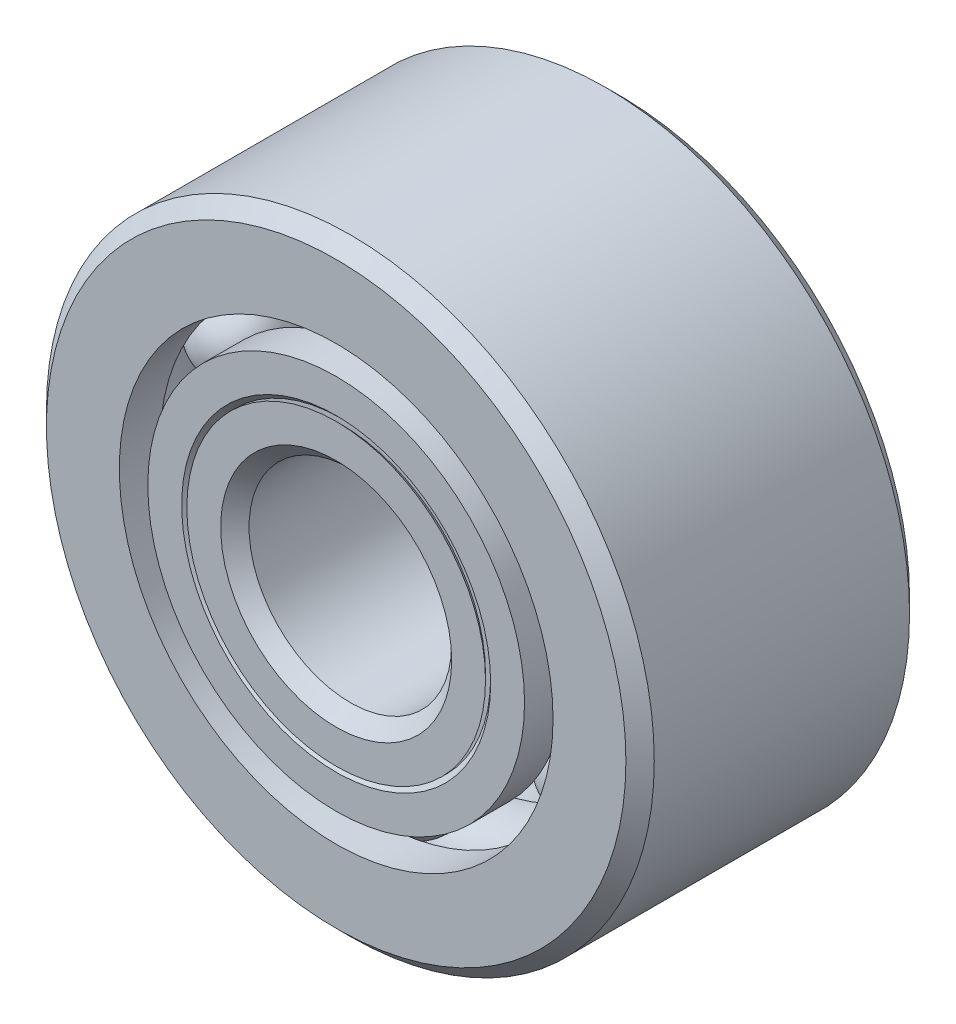
from build123d import *

# Parameters (mm, degrees)
CIRPATTERN1_COUNT = 6


with BuildPart() as part:
    # Sketch1 → Revolve1 (revolve)
    with BuildSketch(Plane(origin=(0, 0, 0), x_dir=(0, 0, -1), z_dir=(1, 0, 0)), mode=Mode.PRIVATE) as revolve1_sk:
        with BuildLine():
            Line((6.3, 15), (-6.3, 15))
            Line((-6.3, 15), (-7, 14.3))
            Line((-7, 14.3), (-7, 10.703296703))
            Line((-7, 10.703296703), (-5, 10.703296703))
            ThreePointArc((-5, 10.703296703), (-3, 12.120053361), (-1, 10.703296703))
            Line((-1, 10.703296703), (1, 10.703296703))
            ThreePointArc((1, 10.703296703), (3, 12.120053361), (5, 10.703296703))
            Line((5, 10.703296703), (7, 10.703296703))
            Line((7, 10.703296703), (7, 14.3))
            Line((7, 14.3), (6.3, 15))
        make_face()
    revolve(revolve1_sk.sketch.rotate(Axis((0, 0, 7), (0, 0, -1)), 90), axis=Axis((0, 0, 7), (0, 0, -1)))


with BuildPart() as body_2:
    # Sketch3 → Revolve3 (revolve)
    with BuildSketch(Plane(origin=(0, 0, 0), x_dir=(0, 0, -1), z_dir=(1, 0, 0)), mode=Mode.PRIVATE) as revolve3_sk:
        with BuildLine():
            Line((-1, 9.296703297), (1, 9.296703297))
            ThreePointArc((1, 9.296703297), (3, 7.879946639), (5, 9.296703297))
            Line((5, 9.296703297), (7, 9.296703297))
            Line((7, 9.296703297), (7, 5.7))
            Line((7, 5.7), (6.3, 5))
            Line((6.3, 5), (-6.3, 5))
            Line((-6.3, 5), (-7, 5.7))
            Line((-7, 5.7), (-7, 7.371351648))
            Line((-7, 7.371351648), (-6.746, 7.117351648))
            Line((-6.746, 7.117351648), (-6.746, 7.371351648))
            Line((-6.746, 7.371351648), (-7, 7.625351648))
            Line((-7, 7.625351648), (-7, 9.296703297))
            Line((-7, 9.296703297), (-5, 9.296703297))
            ThreePointArc((-5, 9.296703297), (-3, 7.879946639), (-1, 9.296703297))
        make_face()
    revolve(revolve3_sk.sketch.rotate(Axis((0, 0, 7), (0, 0, -1)), 90), axis=Axis((0, 0, 7), (0, 0, -1)))


with BuildPart() as body_3:
    # Sketch4 → Revolve4 (revolve)
    with BuildSketch(Plane(origin=(0, 0, 0), x_dir=(0, 0, -1), z_dir=(1, 0, 0))):
        with BuildLine():
            Line((-5.120053361, 10), (-0.879946639, 10))
            ThreePointArc((-0.879946639, 10), (-3, 12.120053361), (-5.120053361, 10))
        make_face()
        with BuildLine():
            Line((0.879946639, 10), (5.120053361, 10))
            ThreePointArc((5.120053361, 10), (3, 12.120053361), (0.879946639, 10))
        make_face()
    revolve(axis=Axis((0, 10, 0.879946639), (0, 0, -1)))


with BuildPart() as cirpattern1_1:
    # CirPattern1: pattern copy
    add(body_3.part.rotate(Axis((0, 0, 0), (0, 0, 1)), 1 * 360 / CIRPATTERN1_COUNT))


with BuildPart() as cirpattern1_2:
    # CirPattern1: pattern copy
    add(body_3.part.rotate(Axis((0, 0, 0), (0, 0, 1)), 2 * 360 / CIRPATTERN1_COUNT))


with BuildPart() as cirpattern1_3:
    # CirPattern1: pattern copy
    add(body_3.part.rotate(Axis((0, 0, 0), (0, 0, 1)), 3 * 360 / CIRPATTERN1_COUNT))


with BuildPart() as cirpattern1_4:
    # CirPattern1: pattern copy
    add(body_3.part.rotate(Axis((0, 0, 0), (0, 0, 1)), 4 * 360 / CIRPATTERN1_COUNT))


with BuildPart() as cirpattern1_5:
    # CirPattern1: pattern copy
    add(body_3.part.rotate(Axis((0, 0, 0), (0, 0, 1)), 5 * 360 / CIRPATTERN1_COUNT))


solid = Compound([part.part, body_2.part, body_3.part, cirpattern1_1.part, cirpattern1_2.part, cirpattern1_3.part, cirpattern1_4.part, cirpattern1_5.part])
